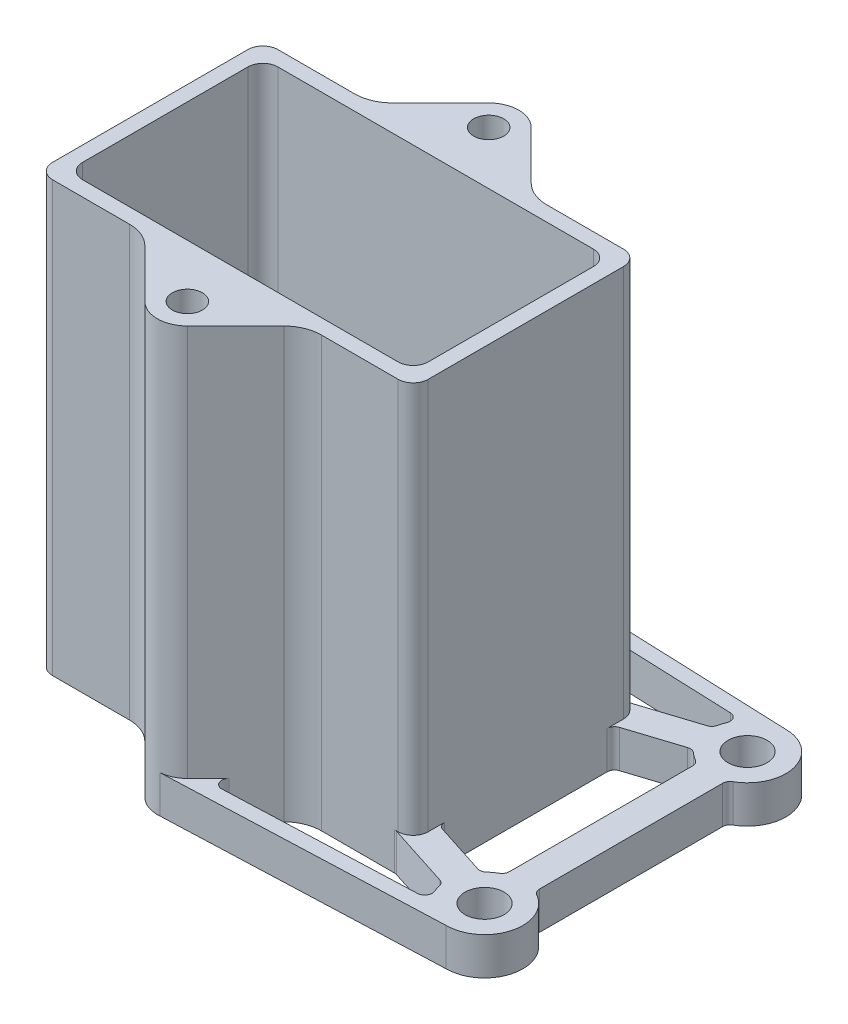
from build123d import *

# Parameters (mm, degrees)
SKETCH1_W           = 50
SKETCH1_H           = 30
BOSS_EXTRUDE1_DEPTH = 3
SKETCH2_W           = 50
SKETCH2_H           = 30
SKETCH2_W_2         = 46
SKETCH2_H_2         = 26
BOSS_EXTRUDE2_DEPTH = 54.15
SKETCH3_R           = 2
BOSS_EXTRUDE3_DEPTH = 57.15
FILLET1_R           = 2
SKETCH4_R           = 5
CUT_EXTRUDE1_DEPTH  = 2
SKETCH5_R           = 2.6
BOSS_EXTRUDE4_DEPTH = 5
FILLET2_R           = 1
FILLET3_R           = 5


with BuildPart() as part:
    # Sketch1 → Boss-Extrude1 (new body)
    with BuildSketch(Plane(origin=(0, 0, 0), x_dir=(1, 0, 0), z_dir=(0, 1, 0))):
        Rectangle(SKETCH1_W, SKETCH1_H)
    extrude(amount=BOSS_EXTRUDE1_DEPTH)

    # Sketch2 → Boss-Extrude2 (add)
    with BuildSketch(Plane(origin=(0, 3, 0), x_dir=(1, 0, 0), z_dir=(0, 1, 0))):
        Rectangle(SKETCH2_W, SKETCH2_H)
        Rectangle(SKETCH2_W_2, SKETCH2_H_2, mode=Mode.SUBTRACT)
    extrude(amount=BOSS_EXTRUDE2_DEPTH)

    # Sketch3 → Boss-Extrude3 (add)
    with BuildSketch(Plane(origin=(0, 0, 0), x_dir=(1, 0, 0), z_dir=(0, 1, 0))):
        with BuildLine():
            ThreePointArc((2.828427125, 22.878427125), (0, 24.05), (-2.828427125, 22.878427125))
            Line((-2.828427125, 22.878427125), (-10.706854249, 15))
            Line((-10.706854249, 15), (10.706854249, 15))
            Line((10.706854249, 15), (2.828427125, 22.878427125))
        make_face()
        with Locations(Location((0, 20.05, 0), (0, 0, 270))):
            Circle(SKETCH3_R, mode=Mode.SUBTRACT)
    boss_extrude3 = extrude(amount=BOSS_EXTRUDE3_DEPTH)

    # Mirror1: Boss-Extrude3 across plane
    add(boss_extrude3.mirror(Plane.XY))

    # Fillet1
    fillet1_edges = [part.edges().sort_by_distance(p)[0] for p in [
        (23, 30.075, 13),
        (23, 30.075, -13),
        (-23, 30.075, -13),
        (-23, 30.075, 13),
        (25, 28.575, 15),
        (-25, 28.575, 15),
        (-25, 28.575, -15),
        (25, 28.575, -15),
    ]]
    fillet(fillet1_edges, radius=FILLET1_R)

    # Sketch4 → Cut-Extrude1 (cut)
    with BuildSketch(Plane.ZY.offset(25)):
        with Locations((0, 12.7)):
            Circle(SKETCH4_R)
    extrude(amount=-CUT_EXTRUDE1_DEPTH, mode=Mode.SUBTRACT)

    # Sketch5 → Boss-Extrude4 (add)
    with BuildSketch(Plane(origin=(0, 0, 0), x_dir=(1, 0, 0), z_dir=(0, 1, 0))):
        with BuildLine():
            Line((3.807606463, 21.899247787), (33.071665812, 20.752413028))
            ThreePointArc((33.071665812, 20.752413028), (32.286385501, 19.447264326), (31.921557121, 17.96842067))
            Line((31.921557121, 17.96842067), (22.686470591, 15))
            Line((22.686470591, 15), (23, 15))
            ThreePointArc((23, 15), (24.414213562, 14.414213562), (25, 13))
            Line((25, 13), (25, 11.542079833))
            Line((25, 11.542079833), (33.145593843, 14.160306425))
            ThreePointArc((33.145593843, 14.160306425), (33.99577787, 13.37875633), (35, 12.808518358))
            Line((35, 12.808518358), (35, -12.808518358))
            ThreePointArc((35, -12.808518358), (33.99577787, -13.37875633), (33.145593843, -14.160306425))
            Line((33.145593843, -14.160306425), (25, -11.542079833))
            Line((25, -11.542079833), (25, -13))
            ThreePointArc((25, -13), (24.414213562, -14.414213562), (23, -15))
            Line((23, -15), (22.686470591, -15))
            Line((22.686470591, -15), (31.921557121, -17.96842067))
            ThreePointArc((31.921557121, -17.96842067), (32.286385501, -19.447264326), (33.071665812, -20.752413028))
            Line((33.071665812, -20.752413028), (3.807606463, -21.899247787))
            Line((3.807606463, -21.899247787), (2.828427125, -22.878427125))
            ThreePointArc((2.828427125, -22.878427125), (1.674272914, -23.682741418), (0.31303276, -24.0377325))
            Line((0.31303276, -24.0377325), (37, -22.6))
            ThreePointArc((37, -22.6), (41.996826812, -18.520647741), (39, -12.808518358))
            Line((39, -12.808518358), (39, 12.808518358))
            ThreePointArc((39, 12.808518358), (41.996826812, 18.520647741), (37, 22.6))
            Line((37, 22.6), (0.31303276, 24.0377325))
            ThreePointArc((0.31303276, 24.0377325), (1.674272914, 23.682741418), (2.828427125, 22.878427125))
            Line((2.828427125, 22.878427125), (3.807606463, 21.899247787))
        make_face()
        with Locations(Location((37, 17.5, 0), (0, 0, 270))):
            Circle(SKETCH5_R, mode=Mode.SUBTRACT)
        with Locations(Location((37, -17.5, 0), (0, 0, 270))):
            Circle(SKETCH5_R, mode=Mode.SUBTRACT)
    extrude(amount=BOSS_EXTRUDE4_DEPTH)

    # Fillet2
    fillet2_edges = [part.edges().sort_by_distance(p)[0] for p in [
        (3.807606463, 2.5, -21.899247787),
        (33.071665812, 2.5, -20.752413028),
        (31.921557121, 2.5, -17.96842067),
        (22.686470591, 2.5, -15),
        (25, 2.5, -11.542079833),
        (33.145593843, 2.5, -14.160306425),
        (35, 2.5, -12.808518358),
        (35, 2.5, 12.808518358),
        (33.145593843, 2.5, 14.160306425),
        (25, 2.5, 11.542079833),
        (22.686470591, 2.5, 15),
        (31.921557121, 2.5, 17.96842067),
        (33.071665812, 2.5, 20.752413028),
        (3.807606463, 2.5, 21.899247787),
        (39, 2.5, 12.808518358),
        (39, 2.5, -12.808518358),
    ]]
    fillet(fillet2_edges, radius=FILLET2_R)

    # Fillet3
    fillet3_edges = [part.edges().sort_by_distance(p)[0] for p in [
        (10.706854249, 28.575, -15),
        (-10.706854249, 28.575, -15),
        (-10.706854249, 28.575, 15),
        (10.706854249, 28.575, 15),
    ]]
    fillet(fillet3_edges, radius=FILLET3_R)


solid = part.part
